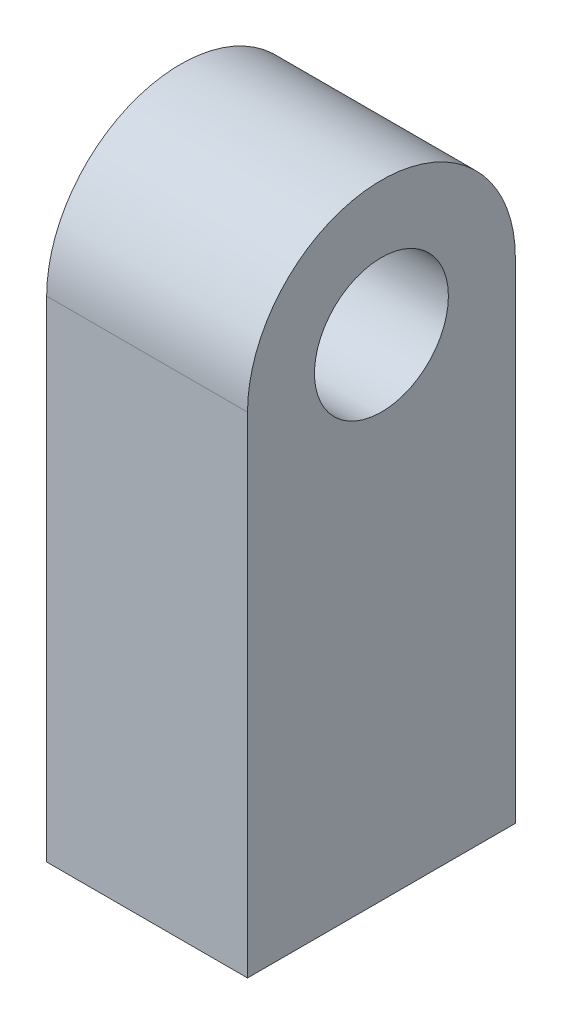
from build123d import *

# Parameters (mm, degrees)
SKETCH_1_W          = 9
SKETCH_1_H          = 12
EXTRUDE_1_DEPTH     = 28
SKETCH_2_OUTSIDE_W  = 20.352
SKETCH_2_OUTSIDE_H  = 36.352
CUT_EXTRUDE_1_DEPTH = 31.01666204
SKETCH_3_R          = 3
CUT_EXTRUDE_2_DEPTH = 10
SKETCH_4_R          = 3
CUT_EXTRUDE_3_DEPTH = 30.978055751


with BuildPart() as part:
    # 草图1 → 凸台-拉伸1 (new body)
    with BuildSketch(Plane(origin=(0, 0, 0), x_dir=(1, 0, 0), z_dir=(0, 1, 0))):
        Rectangle(SKETCH_1_W, SKETCH_1_H)
    extrude(amount=EXTRUDE_1_DEPTH)

    # 草图2 outside → 切除-拉伸1 (cut, through all)
    with BuildSketch(Plane(origin=(4.5, 0, 0), x_dir=(0, 0, -1), z_dir=(1, 0, 0))):
        with Locations((0, 14)):
            Rectangle(SKETCH_2_OUTSIDE_W, SKETCH_2_OUTSIDE_H)
        with BuildLine():
            Line((-6, -3.744960893), (-6, 21.958609168))
            ThreePointArc((-6, 21.958609168), (0, 27.958609168), (6, 21.958609168))
            Line((6, 21.958609168), (6, -3.744960893))
            ThreePointArc((6, -3.744960893), (0, -9.744960893), (-6, -3.744960893))
        make_face(mode=Mode.SUBTRACT)
    extrude(amount=-CUT_EXTRUDE_1_DEPTH, mode=Mode.SUBTRACT)

    # 草图3 → 切除-拉伸2 (cut)
    with BuildSketch(Plane.XZ):
        with Locations(Location((0, 0, 0), (0, 0, 270))):
            Circle(SKETCH_3_R)
    extrude(amount=-CUT_EXTRUDE_2_DEPTH, mode=Mode.SUBTRACT)

    # 草图4 → 切除-拉伸3 (cut, through all)
    with BuildSketch(Plane(origin=(4.5, 0, 0), x_dir=(0, 0, -1), z_dir=(1, 0, 0))):
        with Locations((0, 21.958609168)):
            Circle(SKETCH_4_R)
    extrude(amount=-CUT_EXTRUDE_3_DEPTH, mode=Mode.SUBTRACT)


solid = part.part
